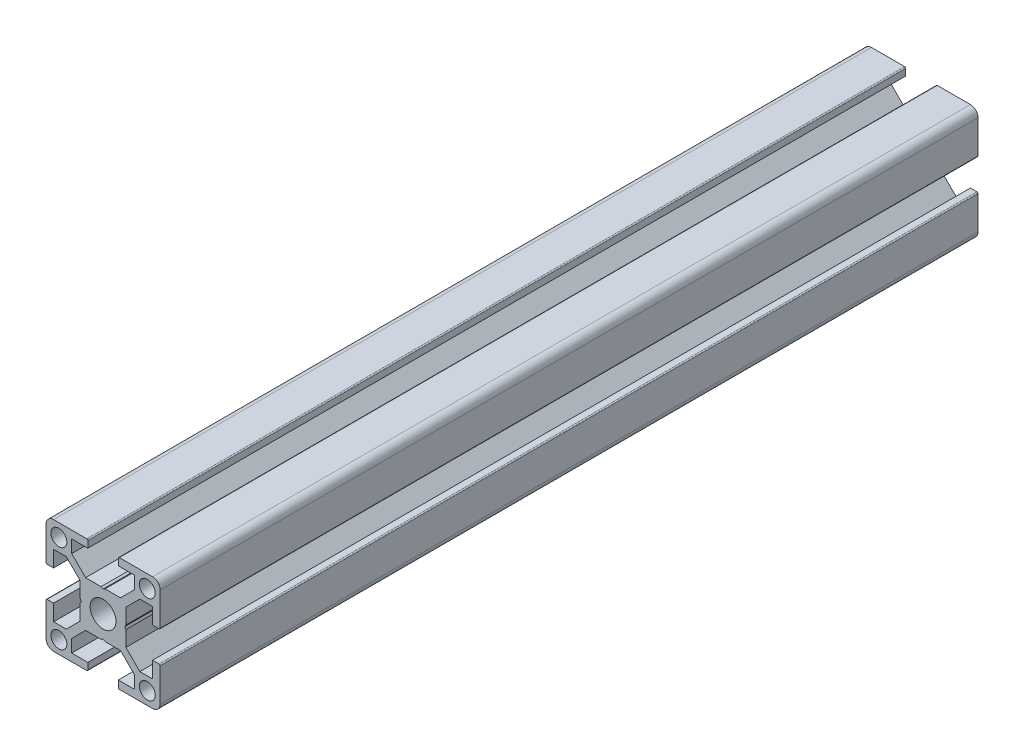
from build123d import *

# Parameters (mm, degrees)
SKETCH1_R           = 2.1
SKETCH1_R_2         = 3.4
BOSS_EXTRUDE1_DEPTH = 215


with BuildPart() as part:
    # Sketch1 → Boss-Extrude1 (new body)
    with BuildSketch(Plane.XY):
        with BuildLine():
            Line((-14.7, 4), (-13, 4))
            Line((-13, 4), (-13, 8.25))
            Line((-13, 8.25), (-9.664213562, 8.25))
            Line((-9.664213562, 8.25), (-6, 4.585786438))
            Line((-6, 4.585786438), (-6, 0.519615242))
            Line((-6, 0.519615242), (-5.7, 0))
            Line((-5.7, 0), (-6, -0.519615242))
            Line((-6, -0.519615242), (-6, -4.585786438))
            Line((-6, -4.585786438), (-9.664213562, -8.25))
            Line((-9.664213562, -8.25), (-13, -8.25))
            Line((-13, -8.25), (-13, -4))
            Line((-13, -4), (-14.7, -4))
            ThreePointArc((-14.7, -4), (-14.912132034, -4.087867966), (-15, -4.3))
            Line((-15, -4.3), (-15, -13))
            ThreePointArc((-15, -13), (-14.414213562, -14.414213562), (-13, -15))
            Line((-13, -15), (-4.3, -15))
            ThreePointArc((-4.3, -15), (-4.087867966, -14.912132034), (-4, -14.7))
            Line((-4, -14.7), (-4, -13))
            Line((-4, -13), (-8.25, -13))
            Line((-8.25, -13), (-8.25, -9.664213562))
            Line((-8.25, -9.664213562), (-4.585786438, -6))
            Line((-4.585786438, -6), (-0.519615242, -6))
            Line((-0.519615242, -6), (0, -5.7))
            Line((0, -5.7), (0.519615242, -6))
            Line((0.519615242, -6), (4.585786438, -6))
            Line((4.585786438, -6), (8.25, -9.664213562))
            Line((8.25, -9.664213562), (8.25, -13))
            Line((8.25, -13), (4, -13))
            Line((4, -13), (4, -14.7))
            ThreePointArc((4, -14.7), (4.087867966, -14.912132034), (4.3, -15))
            Line((4.3, -15), (13, -15))
            ThreePointArc((13, -15), (14.414213562, -14.414213562), (15, -13))
            Line((15, -13), (15, -4.3))
            ThreePointArc((15, -4.3), (14.912132034, -4.087867966), (14.7, -4))
            Line((14.7, -4), (13, -4))
            Line((13, -4), (13, -8.25))
            Line((13, -8.25), (9.664213562, -8.25))
            Line((9.664213562, -8.25), (6, -4.585786438))
            Line((6, -4.585786438), (6, -0.519615242))
            Line((6, -0.519615242), (5.7, 0))
            Line((5.7, 0), (6, 0.519615242))
            Line((6, 0.519615242), (6, 4.585786438))
            Line((6, 4.585786438), (9.664213562, 8.25))
            Line((9.664213562, 8.25), (13, 8.25))
            Line((13, 8.25), (13, 4))
            Line((13, 4), (14.7, 4))
            ThreePointArc((14.7, 4), (14.912132034, 4.087867966), (15, 4.3))
            Line((15, 4.3), (15, 13))
            ThreePointArc((15, 13), (14.414213562, 14.414213562), (13, 15))
            Line((13, 15), (4.3, 15))
            ThreePointArc((4.3, 15), (4.087867966, 14.912132034), (4, 14.7))
            Line((4, 14.7), (4, 13))
            Line((4, 13), (8.25, 13))
            Line((8.25, 13), (8.25, 9.664213562))
            Line((8.25, 9.664213562), (4.585786438, 6))
            Line((4.585786438, 6), (0.519615242, 6))
            Line((0.519615242, 6), (0, 5.7))
            Line((0, 5.7), (-0.519615242, 6))
            Line((-0.519615242, 6), (-4.585786438, 6))
            Line((-4.585786438, 6), (-8.25, 9.664213562))
            Line((-8.25, 9.664213562), (-8.25, 13))
            Line((-8.25, 13), (-4, 13))
            Line((-4, 13), (-4, 14.7))
            ThreePointArc((-4, 14.7), (-4.087867966, 14.912132034), (-4.3, 15))
            Line((-4.3, 15), (-13, 15))
            ThreePointArc((-13, 15), (-14.414213562, 14.414213562), (-15, 13))
            Line((-15, 13), (-15, 4.3))
            ThreePointArc((-15, 4.3), (-14.912132034, 4.087867966), (-14.7, 4))
        make_face()
        with Locations((11.625, 11.625)):
            Circle(SKETCH1_R, mode=Mode.SUBTRACT)
        with Locations((11.625, -11.625)):
            Circle(SKETCH1_R, mode=Mode.SUBTRACT)
        Circle(SKETCH1_R_2, mode=Mode.SUBTRACT)
        with Locations((-11.625, -11.625)):
            Circle(SKETCH1_R, mode=Mode.SUBTRACT)
        with Locations((-11.625, 11.625)):
            Circle(SKETCH1_R, mode=Mode.SUBTRACT)
    extrude(amount=BOSS_EXTRUDE1_DEPTH)


solid = part.part
